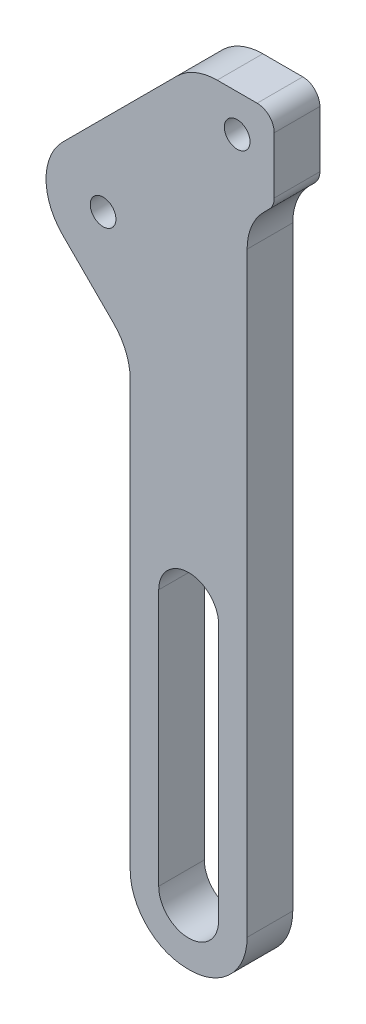
from build123d import *

# Parameters (mm, degrees)
SKETCH1_W                      = 40
SKETCH1_H                      = 137.5
BOSS_EXTRUDE1_DEPTH            = 8
CBORE_FOR_M4_SHCS1_D           = 4.5
CBORE_FOR_M4_SHCS1_CBORE_D     = 8
CBORE_FOR_M4_SHCS1_CBORE_DEPTH = 4
CUT_EXTRUDE1_DEPTH             = 112.893922981
FILLET1_R                      = 10
FILLET2_R                      = 3


with BuildPart() as part:
    # Sketch1 → Boss-Extrude1 (new body)
    with BuildSketch(Plane.XY):
        with Locations((10, -38.75)):
            Rectangle(SKETCH1_W, SKETCH1_H)
        with BuildLine():
            Line((20.25, -52.5), (20.25, -97.5))
            ThreePointArc((20.25, -97.5), (15, -102.75), (9.75, -97.5))
            Line((9.75, -97.5), (9.75, -52.5))
            ThreePointArc((9.75, -52.5), (15, -47.25), (20.25, -52.5))
        make_face(mode=Mode.SUBTRACT)
    extrude(amount=-BOSS_EXTRUDE1_DEPTH)

    # CBORE for M4 SHCS1 (through all)
    with Locations(Plane(origin=(0, 0, -8), x_dir=(1, 0, 0), z_dir=(0, 0, -1))):
        with Locations((0, 0), (23.51, -23.51)):
            CounterBoreHole(CBORE_FOR_M4_SHCS1_D / 2, CBORE_FOR_M4_SHCS1_CBORE_D / 2, CBORE_FOR_M4_SHCS1_CBORE_DEPTH)

    # Sketch6 → Cut-Extrude1 (cut, through all)
    with BuildSketch(Plane.XY):
        with BuildLine():
            Line((-10, -107.5), (4.75, -107.5))
            Line((4.75, -107.5), (4.75, -18.892135624))
            Line((4.75, -18.892135624), (-7.071067812, -7.071067812))
            ThreePointArc((-7.071067812, -7.071067812), (-9.238795322, -3.826834332), (-10, -1.8e-08))
            Line((-10, -1.8e-08), (-10, -107.5))
        make_face()
        with BuildLine():
            Line((-10, 30), (-10, -1.8e-08))
            ThreePointArc((-10, -1.8e-08), (-9.238795329, 3.826834315), (-7.071067812, 7.071067812))
            Line((-7.071067812, 7.071067812), (15.857864376, 30))
            Line((15.857864376, 30), (-10, 30))
        make_face()
        Polygon((25.25, 11.107864376), (25.25, -107.5), (30, -107.5), (30, 15.857864376), align=None)
    extrude(amount=-CUT_EXTRUDE1_DEPTH, mode=Mode.SUBTRACT)

    # Fillet1
    fillet1_edges = [part.edges().sort_by_distance(p)[0] for p in [
        (4.75, -18.892135624, -4),
        (4.75, -107.5, -4),
        (15.857864376, 30, -4),
        (25.25, 11.107864376, -4),
        (25.25, -107.5, -4),
    ]]
    fillet(fillet1_edges, radius=FILLET1_R)

    # Fillet2
    fillet2_edges = [part.edges().sort_by_distance(p)[0] for p in [
        (30, 15.857864376, -4),
        (30, 30, -4),
    ]]
    fillet(fillet2_edges, radius=FILLET2_R)


solid = part.part
